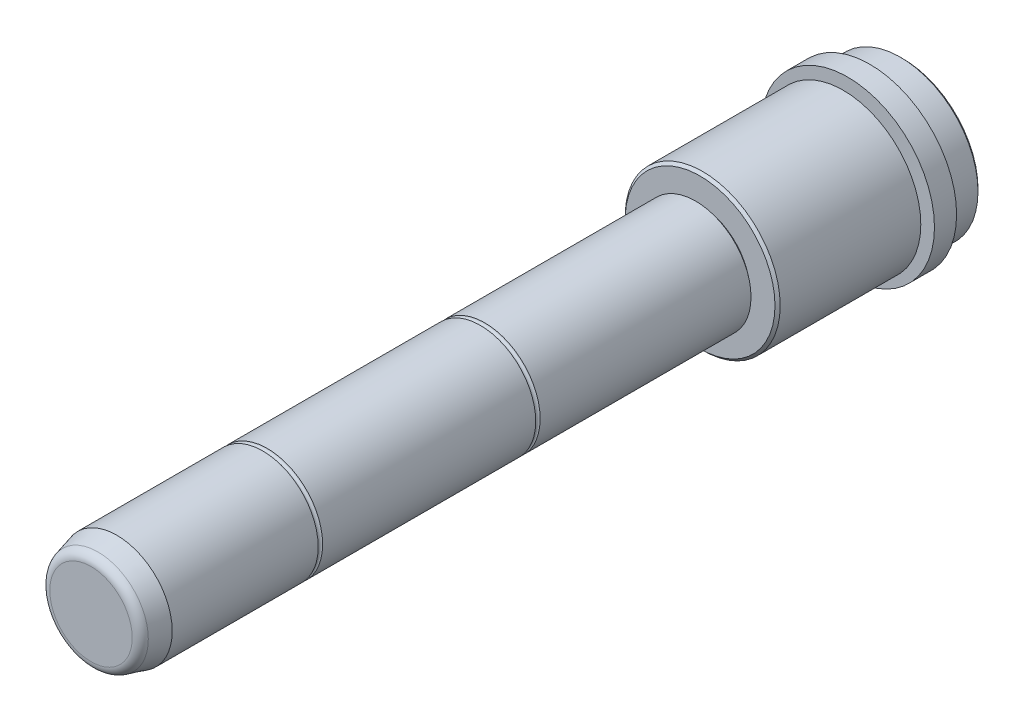
from build123d import *

# Parameters (mm, degrees)
SZKIC1_W = 9
SZKIC1_H = 21
SZKIC3_W = 1.2
SZKIC3_H = 2.1
SZKIC4_W = 6
SZKIC4_H = 23.5
SZKIC5_W = 40
SZKIC5_H = 21
SZKIC6_W = 1.2
SZKIC6_H = 2.1
SZKIC8_W = 165
SZKIC8_H = 15
SZKIC9_W = 1.2
SZKIC9_H = 1.5


with BuildPart() as part:
    # Szkic1 → Obrót1 (revolve)
    with BuildSketch(Plane(origin=(0, 0, 0), x_dir=(0, 0, -1), z_dir=(1, 0, 0))):
        with Locations((-4.5, 10.5)):
            Rectangle(SZKIC1_W, SZKIC1_H)
    revolve(axis=Axis((0, 0, 0), (0, 0, 1)))

    # Szkic2 → Wycięcie-obrót1 (revolve, cut)
    with BuildSketch(Plane(origin=(0, 0, 0), x_dir=(0, 0, -1), z_dir=(1, 0, 0))):
        Polygon((-0.707106781, 21), (0, 20.292893219), (0, 21), align=None)
    revolve(axis=Axis((0, 0, 0), (0, 0, 1)), mode=Mode.SUBTRACT)

    # Szkic3 → Wycięcie-obrót2 (revolve, cut)
    with BuildSketch(Plane(origin=(0, 0, 0), x_dir=(0, 0, -1), z_dir=(1, 0, 0))):
        with Locations((-8.4, 19.95)):
            Rectangle(SZKIC3_W, SZKIC3_H)
    revolve(axis=Axis((0, 0, 0), (0, 0, 1)), mode=Mode.SUBTRACT)

    # Szkic4 → Obrót2 (revolve)
    with BuildSketch(Plane(origin=(0, 0, 0), x_dir=(0, 0, -1), z_dir=(1, 0, 0))):
        with Locations((-12, 11.75)):
            Rectangle(SZKIC4_W, SZKIC4_H)
    revolve(axis=Axis((0, 0, 9), (0, 0, 1)))

    # Szkic5 → Obrót3 (revolve)
    with BuildSketch(Plane(origin=(0, 0, 0), x_dir=(0, 0, -1), z_dir=(1, 0, 0))):
        with Locations((-35, 10.5)):
            Rectangle(SZKIC5_W, SZKIC5_H)
    revolve(axis=Axis((0, 0, 15), (0, 0, 1)))

    # Szkic6 → Wycięcie-obrót3 (revolve, cut)
    with BuildSketch(Plane(origin=(0, 0, 0), x_dir=(0, 0, -1), z_dir=(1, 0, 0))):
        with Locations((-15.6, 19.95)):
            Rectangle(SZKIC6_W, SZKIC6_H)
    revolve(axis=Axis((0, 0, 15), (0, 0, 1)), mode=Mode.SUBTRACT)

    # Szkic7 → Wycięcie-obrót4 (revolve, cut)
    with BuildSketch(Plane(origin=(0, 0, 0), x_dir=(0, 0, -1), z_dir=(1, 0, 0))):
        Polygon((-55, 20.292893219), (-54.292893219, 21), (-55, 21), align=None)
    revolve(axis=Axis((0, 0, 9), (0, 0, 1)), mode=Mode.SUBTRACT)

    # Szkic8 → Obrót4 (revolve)
    with BuildSketch(Plane(origin=(0, 0, 0), x_dir=(0, 0, -1), z_dir=(1, 0, 0))):
        with Locations((-137.5, 7.5)):
            Rectangle(SZKIC8_W, SZKIC8_H)
    revolve(axis=Axis((0, 0, 55), (0, 0, 1)))

    # Szkic9 → Wycięcie-obrót5 (revolve, cut)
    with BuildSketch(Plane(origin=(0, 0, 0), x_dir=(0, 0, -1), z_dir=(1, 0, 0))):
        with Locations((-55.6, 14.25)):
            Rectangle(SZKIC9_W, SZKIC9_H)
    revolve(axis=Axis((0, 0, 55), (0, 0, 1)), mode=Mode.SUBTRACT)

    # Szkic10 → Wycięcie-obrót6 (revolve, cut)
    with BuildSketch(Plane(origin=(0, 0, 0), x_dir=(0, 0, -1), z_dir=(1, 0, 0))):
        Polygon((-220, 13.124355653), (-213, 15), (-220, 15), align=None)
    revolve(axis=Axis((0, 0, 55), (0, 0, 1)), mode=Mode.SUBTRACT)

    # Szkic11 → Wycięcie-obrót7 (revolve, cut)
    with BuildSketch(Plane(origin=(0, 0, 0), x_dir=(0, 0, -1), z_dir=(1, 0, 0))):
        with BuildLine():
            Line((-218.109988565, 13.630782691), (-220, 13.124355653))
            Line((-220, 13.124355653), (-220, 11.167671834))
            ThreePointArc((-220, 11.167671834), (-219.473051018, 12.720013478), (-218.109988565, 13.630782691))
        make_face()
    revolve(axis=Axis((0, 0, 55), (0, 0, 1)), mode=Mode.SUBTRACT)

    # Szkic12 → Wycięcie-obrót8 (revolve, cut)
    with BuildSketch(Plane(origin=(0, 0, 0), x_dir=(0, 0, -1), z_dir=(1, 0, 0))):
        with BuildLine():
            Line((-172.257142857, 15), (-173.457142857, 15))
            ThreePointArc((-173.457142857, 15), (-172.857142857, 14.4), (-172.257142857, 15))
        make_face()
    revolve(axis=Axis((0, 0, 172.257142857), (0, 0, 1)), mode=Mode.SUBTRACT)

    # Szkic13 → Wycięcie-obrót9 (revolve, cut)
    with BuildSketch(Plane(origin=(0, 0, 0), x_dir=(0, 0, -1), z_dir=(1, 0, 0))):
        with BuildLine():
            Line((-113.328570957, 15), (-114.528570957, 15))
            ThreePointArc((-114.528570957, 15), (-113.928570957, 14.4), (-113.328570957, 15))
        make_face()
    revolve(axis=Axis((0, 0, 113.328570957), (0, 0, 1)), mode=Mode.SUBTRACT)


solid = part.part
